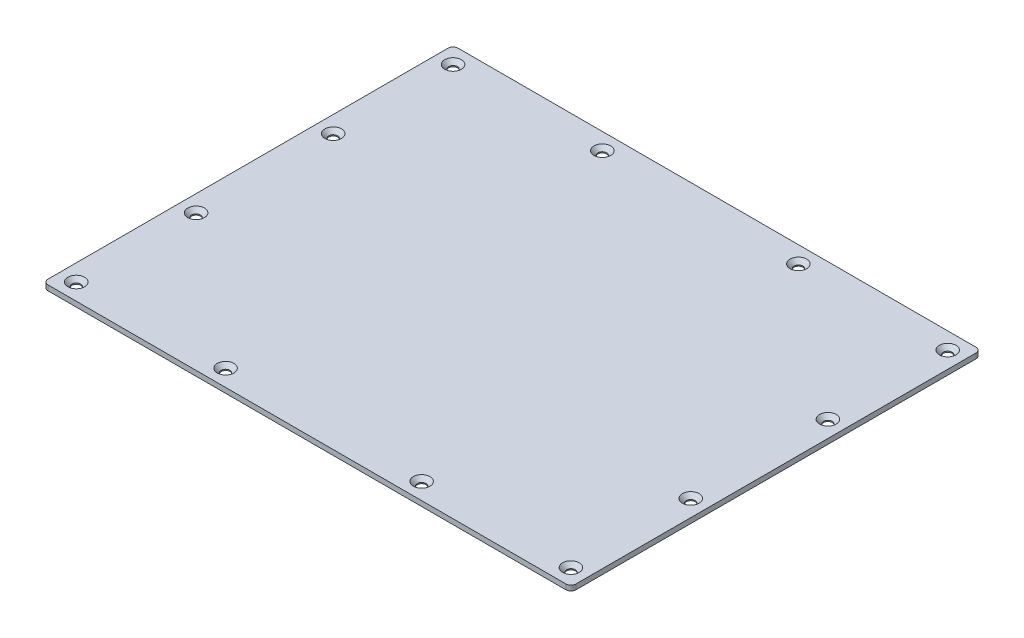
from build123d import *

# Parameters (mm, degrees)
BOSS_EXTRUDE1_DEPTH                            = 2
CSK_FOR_M3_FLAT_HEAD_MACHINE_SCREW1_AT_2_COUNT = 2
CSK_FOR_M3_FLAT_HEAD_MACHINE_SCREW1_AT_2_PITCH = 46.75
CSK_FOR_M3_FLAT_HEAD_MACHINE_SCREW1_AT_3_COUNT = 2
CSK_FOR_M3_FLAT_HEAD_MACHINE_SCREW1_AT_3_PITCH = 58.25
CSK_FOR_M3_FLAT_HEAD_MACHINE_SCREW1_AT_4_COUNT = 2
CSK_FOR_M3_FLAT_HEAD_MACHINE_SCREW1_AT_4_PITCH = 134.75
CSK_FOR_M3_FLAT_HEAD_MACHINE_SCREW1_AT_5_COUNT = 2
CSK_FOR_M3_FLAT_HEAD_MACHINE_SCREW1_AT_5_PITCH = 193
CSK_FOR_M3_FLAT_HEAD_MACHINE_SCREW1_AT_6_COUNT = 2
CSK_FOR_M3_FLAT_HEAD_MACHINE_SCREW1_AT_6_PITCH = 198.581375008
CSK_FOR_M3_FLAT_HEAD_MACHINE_SCREW1_AT_7_COUNT = 2
CSK_FOR_M3_FLAT_HEAD_MACHINE_SCREW1_AT_7_PITCH = 217.483476384
CSK_FOR_M3_FLAT_HEAD_MACHINE_SCREW1_AT_8_COUNT = 2
CSK_FOR_M3_FLAT_HEAD_MACHINE_SCREW1_AT_8_PITCH = 242.606677567
CSK_FOR_M3_FLAT_HEAD_MACHINE_SCREW1_AT_9_COUNT = 2
CSK_FOR_M3_FLAT_HEAD_MACHINE_SCREW1_AT_9_PITCH = 199.415552302
CSK_FOR_M3_FLAT_HEAD_MACHINE_SCREW1_AT_1_COUNT = 2
CSK_FOR_M3_FLAT_HEAD_MACHINE_SCREW1_AT_1_PITCH = 158.120405072
CSK_FOR_M3_FLAT_HEAD_MACHINE_SCREW1_2_COUNT    = 2
CSK_FOR_M3_FLAT_HEAD_MACHINE_SCREW1_2_PITCH    = 147
CSK_FOR_M3_FLAT_HEAD_MACHINE_SCREW1_3_COUNT    = 2
CSK_FOR_M3_FLAT_HEAD_MACHINE_SCREW1_3_PITCH    = 100.25


with BuildPart() as part:
    # Sketch1 → Boss-Extrude1 (new body)
    with BuildSketch(Plane(origin=(0, 0, 0), x_dir=(1, 0, 0), z_dir=(0, 1, 0))):
        with BuildLine():
            Line((103, -78), (103, 78))
            ThreePointArc((103, 78), (102.414213562, 79.414213562), (101, 80))
            Line((101, 80), (-101, 80))
            ThreePointArc((-101, 80), (-102.414213562, 79.414213562), (-103, 78))
            Line((-103, 78), (-103, -78))
            ThreePointArc((-103, -78), (-102.414213562, -79.414213562), (-101, -80))
            Line((-101, -80), (101, -80))
            ThreePointArc((101, -80), (102.414213562, -79.414213562), (103, -78))
        make_face()
    extrude(amount=BOSS_EXTRUDE1_DEPTH)

    # Sketch3 → CSK for M3 Flat Head Machine Screw1 (revolve, cut)
    with BuildSketch(Plane(origin=(-96.5, 2, -73.5), x_dir=(0, 0, 1), z_dir=(1, 0, 0))):
        Polygon((0, 0), (0, 2), (1.725, 2), (1.7, 1.975), (1.7, 1.55), (3.25, 0), align=None)
    csk_for_m3_flat_head_machine_screw1 = revolve(axis=Axis((-96.5, 8.35, -73.5), (0, -1, 0)), mode=Mode.SUBTRACT)

    # CSK for M3 Flat Head Machine Screw1 at 2: CSK for M3 Flat Head Machine Screw1 ×2
    with Locations(*[(0, 0, i * CSK_FOR_M3_FLAT_HEAD_MACHINE_SCREW1_AT_2_PITCH) for i in range(1, CSK_FOR_M3_FLAT_HEAD_MACHINE_SCREW1_AT_2_COUNT)]):
        add(csk_for_m3_flat_head_machine_screw1, mode=Mode.SUBTRACT)

    # CSK for M3 Flat Head Machine Screw1 at 3: CSK for M3 Flat Head Machine Screw1 ×2
    with Locations(*[(i * CSK_FOR_M3_FLAT_HEAD_MACHINE_SCREW1_AT_3_PITCH, 0, 0) for i in range(1, CSK_FOR_M3_FLAT_HEAD_MACHINE_SCREW1_AT_3_COUNT)]):
        add(csk_for_m3_flat_head_machine_screw1, mode=Mode.SUBTRACT)

    # CSK for M3 Flat Head Machine Screw1 at 4: CSK for M3 Flat Head Machine Screw1 ×2
    with Locations(*[(i * CSK_FOR_M3_FLAT_HEAD_MACHINE_SCREW1_AT_4_PITCH, 0, 0) for i in range(1, CSK_FOR_M3_FLAT_HEAD_MACHINE_SCREW1_AT_4_COUNT)]):
        add(csk_for_m3_flat_head_machine_screw1, mode=Mode.SUBTRACT)

    # CSK for M3 Flat Head Machine Screw1 at 5: CSK for M3 Flat Head Machine Screw1 ×2
    with Locations(*[(i * CSK_FOR_M3_FLAT_HEAD_MACHINE_SCREW1_AT_5_PITCH, 0, 0) for i in range(1, CSK_FOR_M3_FLAT_HEAD_MACHINE_SCREW1_AT_5_COUNT)]):
        add(csk_for_m3_flat_head_machine_screw1, mode=Mode.SUBTRACT)

    # CSK for M3 Flat Head Machine Screw1 at 6: CSK for M3 Flat Head Machine Screw1 ×2
    with Locations(*[Vector(0.9718937639161328, 0, 0.2354198625030021) * (i * CSK_FOR_M3_FLAT_HEAD_MACHINE_SCREW1_AT_6_PITCH) for i in range(1, CSK_FOR_M3_FLAT_HEAD_MACHINE_SCREW1_AT_6_COUNT)]):
        add(csk_for_m3_flat_head_machine_screw1, mode=Mode.SUBTRACT)

    # CSK for M3 Flat Head Machine Screw1 at 7: CSK for M3 Flat Head Machine Screw1 ×2
    with Locations(*[Vector(0.8874237399965582, 0, 0.46095455924691864) * (i * CSK_FOR_M3_FLAT_HEAD_MACHINE_SCREW1_AT_7_PITCH) for i in range(1, CSK_FOR_M3_FLAT_HEAD_MACHINE_SCREW1_AT_7_COUNT)]):
        add(csk_for_m3_flat_head_machine_screw1, mode=Mode.SUBTRACT)

    # CSK for M3 Flat Head Machine Screw1 at 8: CSK for M3 Flat Head Machine Screw1 ×2
    with Locations(*[Vector(0.7955263306668907, 0, 0.6059190186944727) * (i * CSK_FOR_M3_FLAT_HEAD_MACHINE_SCREW1_AT_8_PITCH) for i in range(1, CSK_FOR_M3_FLAT_HEAD_MACHINE_SCREW1_AT_8_COUNT)]):
        add(csk_for_m3_flat_head_machine_screw1, mode=Mode.SUBTRACT)

    # CSK for M3 Flat Head Machine Screw1 at 9: CSK for M3 Flat Head Machine Screw1 ×2
    with Locations(*[Vector(0.6757246285173452, 0, 0.7371541402007424) * (i * CSK_FOR_M3_FLAT_HEAD_MACHINE_SCREW1_AT_9_PITCH) for i in range(1, CSK_FOR_M3_FLAT_HEAD_MACHINE_SCREW1_AT_9_COUNT)]):
        add(csk_for_m3_flat_head_machine_screw1, mode=Mode.SUBTRACT)

    # CSK for M3 Flat Head Machine Screw1 at 1: CSK for M3 Flat Head Machine Screw1 ×2
    with Locations(*[Vector(0.3683901516292669, 0, 0.9296712839399558) * (i * CSK_FOR_M3_FLAT_HEAD_MACHINE_SCREW1_AT_1_PITCH) for i in range(1, CSK_FOR_M3_FLAT_HEAD_MACHINE_SCREW1_AT_1_COUNT)]):
        add(csk_for_m3_flat_head_machine_screw1, mode=Mode.SUBTRACT)

    # CSK for M3 Flat Head Machine Screw1  2: CSK for M3 Flat Head Machine Screw1 ×2
    with Locations(*[(0, 0, i * CSK_FOR_M3_FLAT_HEAD_MACHINE_SCREW1_2_PITCH) for i in range(1, CSK_FOR_M3_FLAT_HEAD_MACHINE_SCREW1_2_COUNT)]):
        add(csk_for_m3_flat_head_machine_screw1, mode=Mode.SUBTRACT)

    # CSK for M3 Flat Head Machine Screw1  3: CSK for M3 Flat Head Machine Screw1 ×2
    with Locations(*[(0, 0, i * CSK_FOR_M3_FLAT_HEAD_MACHINE_SCREW1_3_PITCH) for i in range(1, CSK_FOR_M3_FLAT_HEAD_MACHINE_SCREW1_3_COUNT)]):
        add(csk_for_m3_flat_head_machine_screw1, mode=Mode.SUBTRACT)


solid = part.part
